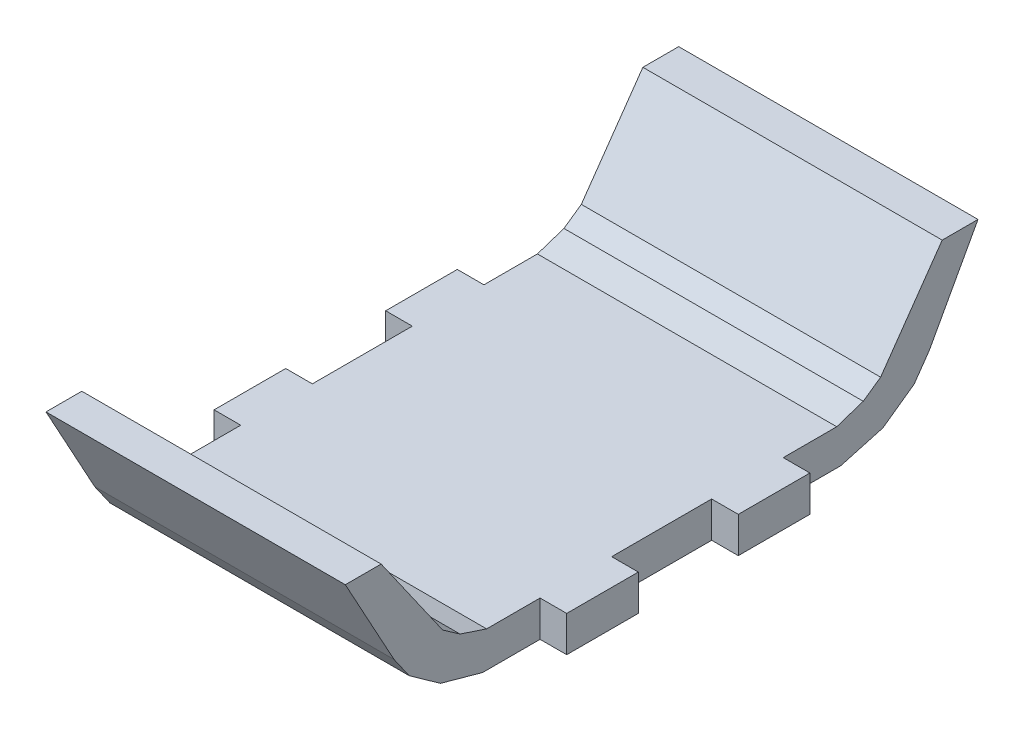
from build123d import *

# Parameters (mm, degrees)
EXTRUDE_1_DEPTH      = 2.5
EXTRUDE_2_DEPTH      = 10.45
EXTRUDE_2_DEPTH_BACK = 10.45


with BuildPart() as part:
    # 스케치2 → 보스-돌출1 (new body)
    with BuildSketch(Plane(origin=(0, 0, 0), x_dir=(1, 0, 0), z_dir=(0, 1, 0))):
        Polygon((-10.45, 12.5), (10.45, 12.5), (10.45, 8.49), (12.309935206, 8.49), (12.309935206, 3.49), (10.45, 3.49), (10.45, -3.49), (12.309935206, -3.49), (12.309935206, -8.49), (10.45, -8.49), (10.45, -12.5), (-10.45, -12.5), (-10.45, -8.49), (-12.309935206, -8.49), (-12.309935206, -3.49), (-10.45, -3.49), (-10.45, 3.49), (-12.309935206, 3.49), (-12.309935206, 8.49), (-10.45, 8.49), align=None)
    extrude(amount=EXTRUDE_1_DEPTH)

    # 스케치3 → 보스-돌출2 (add, two sides: drawn at the far end of the back side and taken through both)
    with BuildSketch(Plane(origin=(0, 0, 0), x_dir=(0, 0, -1), z_dir=(1, 0, 0)).offset(-EXTRUDE_2_DEPTH_BACK)):
        Polygon((0, 0), (12.5, 0), (15.446494384, 0.816274423), (17.628816823, 2.372016775), (18.685999924, 3.881830714), (22.088144039, 10.103695427), (19.588144039, 10.103695427), (15.289438896, 3.964508245), (14.076540474, 3.115227628), (12.22303717, 2.5), (-12.347890055, 2.5), (-12.22303717, 2.5), (-14.076540474, 3.115227628), (-15.289438896, 3.964508245), (-19.588144039, 10.103695427), (-22.088144039, 10.103695427), (-18.685999924, 3.881830714), (-17.628816823, 2.372016775), (-15.446494384, 0.816274423), (-12.5, 0), align=None)
    extrude(amount=EXTRUDE_2_DEPTH + EXTRUDE_2_DEPTH_BACK)


solid = part.part
